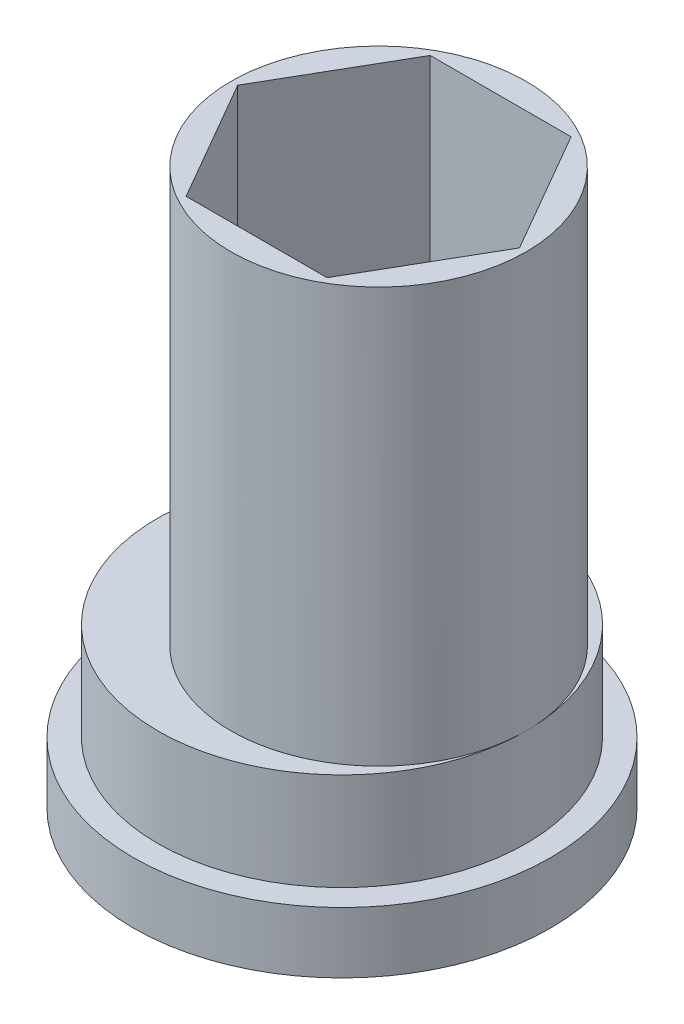
from build123d import *

# Parameters (mm, degrees)
SKETCH1_R           = 7.55
SKETCH1_R_2         = 6.05
BOSS_EXTRUDE1_DEPTH = 4
BOSS_EXTRUDE2_START = -4
SKETCH1_4_R         = 8.55
BOSS_EXTRUDE2_DEPTH = 2.5
SKETCH1_5_R         = 6.05
BOSS_EXTRUDE3_DEPTH = 17


with BuildPart() as part:
    # Sketch1 → Boss-Extrude1 (new body)
    # profile 1 of 2: a face of its own
    with BuildSketch(Plane(origin=(0, 0, 0), x_dir=(1, 0, 0), z_dir=(0, 1, 0))):
        with Locations(Location((-1.5, 0, 0), (0, 0, 270))):
            Circle(SKETCH1_R)
        Circle(SKETCH1_R_2, mode=Mode.SUBTRACT)
    # profile 2 of 2: a face of its own
    with BuildSketch(Plane(origin=(0, 0, 0), x_dir=(1, 0, 0), z_dir=(0, 1, 0))):
        Circle(SKETCH1_R_2)
        Polygon((2.886751346, -5), (5.773502692, 0), (2.886751346, 5), (-2.886751346, 5), (-5.773502692, 0), (-2.886751346, -5), align=None, mode=Mode.SUBTRACT)
    extrude(amount=-BOSS_EXTRUDE1_DEPTH)

    # Sketch1<4> → Boss-Extrude2 (add)
    with BuildSketch(Plane(origin=(0, 0, 0), x_dir=(1, 0, 0), z_dir=(0, 1, 0)).offset(BOSS_EXTRUDE2_START)):
        with Locations(Location((-1.5, 0, 0), (0, 0, 270))):
            Circle(SKETCH1_4_R)
        Polygon((5.773502692, 0), (2.886751346, 5), (-2.886751346, 5), (-5.773502692, 0), (-2.886751346, -5), (2.886751346, -5), align=None, mode=Mode.SUBTRACT)
    extrude(amount=-BOSS_EXTRUDE2_DEPTH)

    # Sketch1<5> → Boss-Extrude3 (add)
    with BuildSketch(Plane(origin=(0, 0, 0), x_dir=(1, 0, 0), z_dir=(0, 1, 0))):
        Circle(SKETCH1_5_R)
        Polygon((2.886751346, -5), (5.773502692, 0), (2.886751346, 5), (-2.886751346, 5), (-5.773502692, 0), (-2.886751346, -5), align=None, mode=Mode.SUBTRACT)
    extrude(amount=BOSS_EXTRUDE3_DEPTH)


solid = part.part
